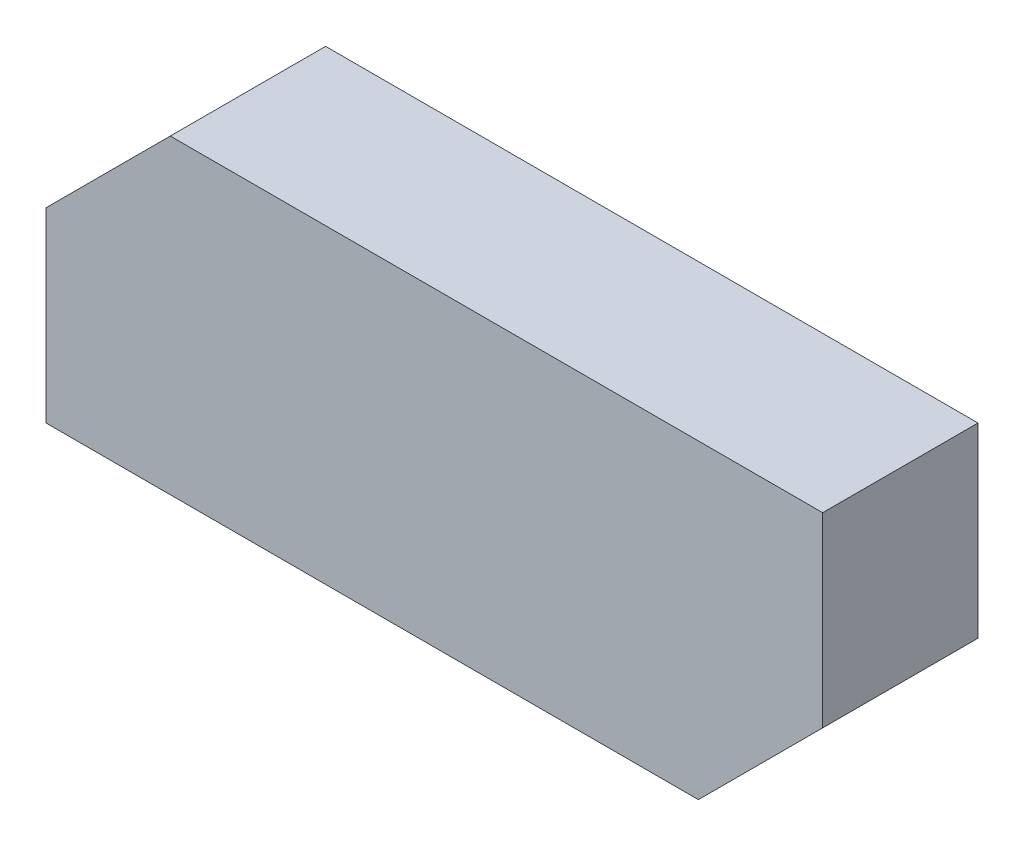
from build123d import *

# Parameters (mm, degrees)
SKETCH_1_W      = 50
SKETCH_1_H      = 20
EXTRUDE_1_DEPTH = 10
CHAMFER_1_SIZE  = 8


with BuildPart() as part:
    # 草图1 → 凸台-拉伸1 (new body)
    with BuildSketch(Plane.XY):
        Rectangle(SKETCH_1_W, SKETCH_1_H)
    extrude(amount=EXTRUDE_1_DEPTH)

    # 倒角1
    chamfer_1_edges = [part.edges().sort_by_distance(p)[0] for p in [
        (25, -10, 5),
        (-25, 10, 5),
    ]]
    chamfer(chamfer_1_edges, length=CHAMFER_1_SIZE)


solid = part.part
